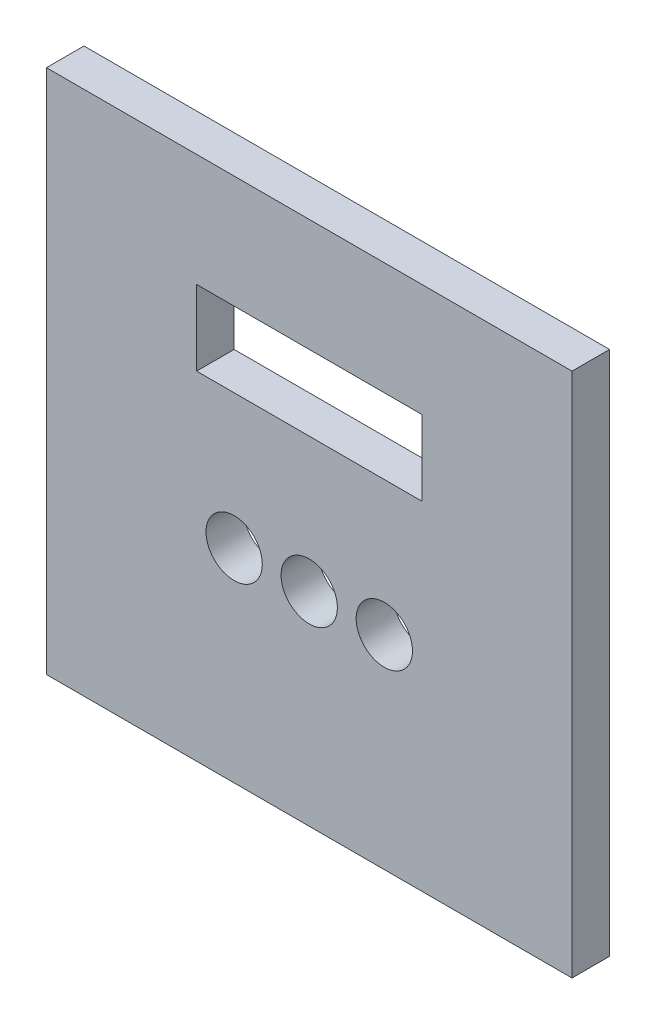
from build123d import *

# Parameters (mm, degrees)
SKETCH1_W           = 140
SKETCH1_H           = 140
BOSS_EXTRUDE1_DEPTH = 10
SKETCH2_W           = 60
SKETCH2_H           = 20
CUT_EXTRUDE2_DEPTH  = 100.498743711
SKETCH3_R           = 7.5
CUT_EXTRUDE3_DEPTH  = 100.498743711


with BuildPart() as part:
    # Sketch1 → Boss-Extrude1 (new body)
    with BuildSketch(Plane.XY):
        Rectangle(SKETCH1_W, SKETCH1_H)
    extrude(amount=BOSS_EXTRUDE1_DEPTH)

    # Sketch2 → Cut-Extrude2 (cut, through all)
    with BuildSketch(Plane.XY.offset(10)):
        with Locations((0, 30)):
            Rectangle(SKETCH2_W, SKETCH2_H)
    extrude(amount=-CUT_EXTRUDE2_DEPTH, mode=Mode.SUBTRACT)

    # Sketch3 → Cut-Extrude3 (cut, through all)
    with BuildSketch(Plane.XY.offset(10)):
        with Locations((-20, -15.823655397)):
            Circle(SKETCH3_R)
        with Locations((0, -15.823655397)):
            Circle(SKETCH3_R)
        with Locations((20, -15.823655397)):
            Circle(SKETCH3_R)
    extrude(amount=-CUT_EXTRUDE3_DEPTH, mode=Mode.SUBTRACT)


solid = part.part
